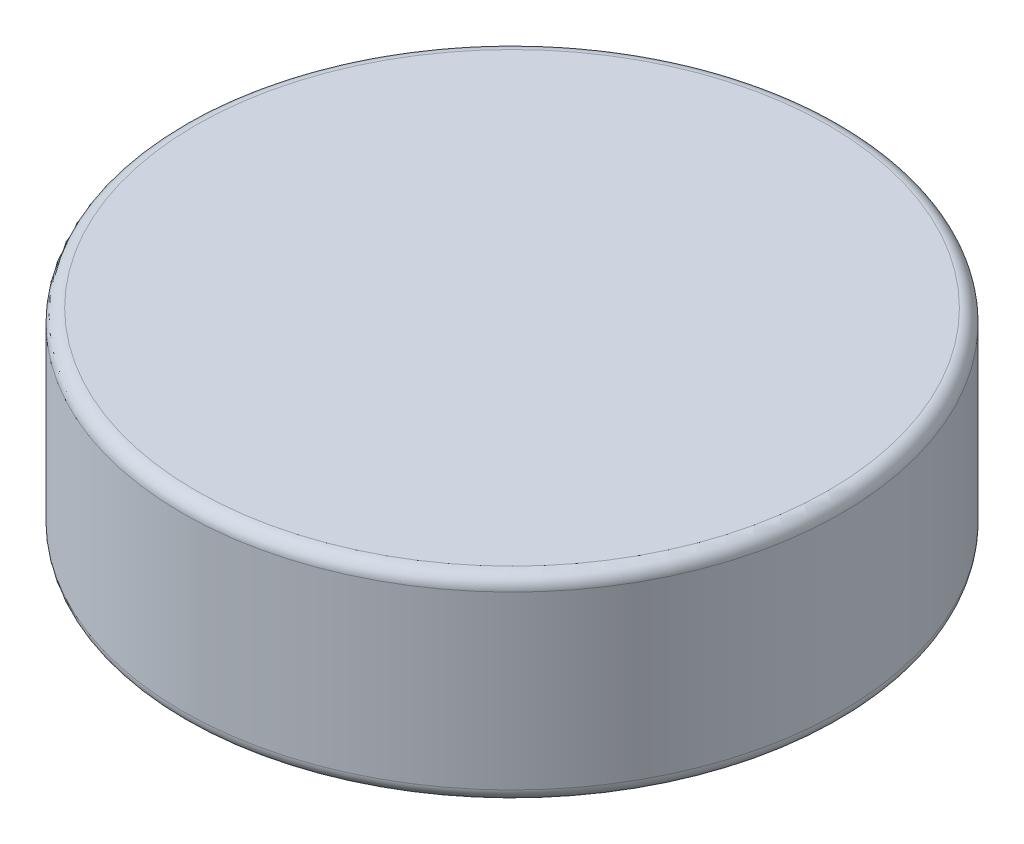
from build123d import *

# Parameters (mm, degrees)
SKETCH_1_R      = 5
EXTRUDE_1_DEPTH = 3
FILLET_1_R      = 0.2


with BuildPart() as part:
    # Эскиз1 → Бобышка-Вытянуть1 (new body)
    with BuildSketch(Plane(origin=(0, 0, 0), x_dir=(1, 0, 0), z_dir=(0, 1, 0))):
        with Locations(Location((0, 0, 0), (0, 0, 270))):
            Circle(SKETCH_1_R)
    extrude(amount=EXTRUDE_1_DEPTH)

    # Скругление1
    fillet_1_edges = [part.edges().sort_by_distance(p)[0] for p in [
        (0, 0, -5),
        (0, 3, -5),
    ]]
    fillet(fillet_1_edges, radius=FILLET_1_R)


solid = part.part
